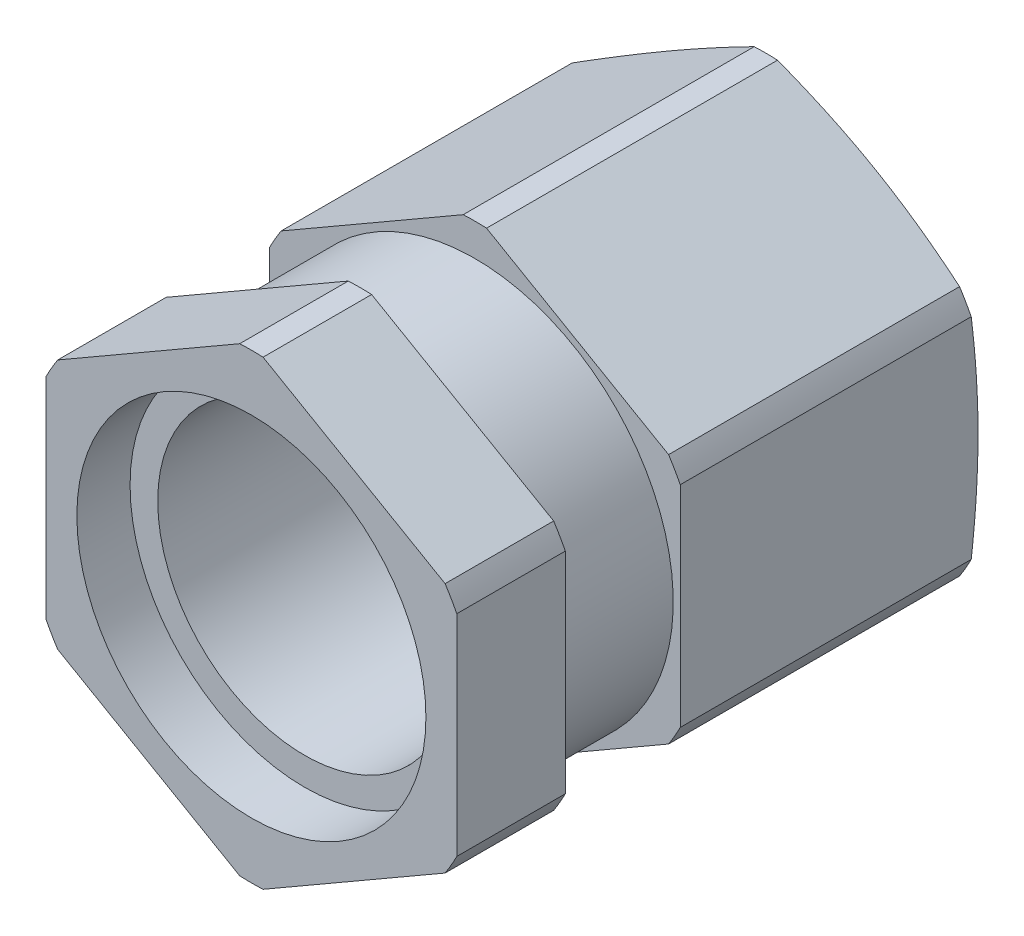
from build123d import *

# Parameters (mm, degrees)
SKETCH2_OUTSIDE_W = 16.808
SKETCH2_OUTSIDE_H = 16.808
EXTRUDE2_DEPTH    = 15.748315158


with BuildPart() as part:
    # Sketch1 → Revolve1 (revolve)
    with BuildSketch(Plane(origin=(0, 0, 0), x_dir=(0, 0, -1), z_dir=(1, 0, 0)), mode=Mode.PRIVATE) as revolve1_sk:
        Polygon((0, 0), (0, 3.5), (-0.514462449, 5.42), (-7.35, 5.42), (-7.35, 4.66), (-10.05, 4.66), (-10.05, 5.42), (-12.6, 5.42), (-12.6, 4.1), (-11.35, 4.1), (-11.35, 3.45), (-6.5, 3.45), (-6.5, 1.5), (-4.801290929, 1.5), (-3.9, 0), align=None)
    revolve(revolve1_sk.sketch.rotate(Axis((0, 0, 0), (0, 0, 1)), 90), axis=Axis((0, 0, 0), (0, 0, 1)))

    # Sketch2 outside → Extrude2 (cut, through all)
    with BuildSketch(Plane(origin=(0, 0, 0), x_dir=(-1, 0, 0), z_dir=(0, 0, -1))):
        Rectangle(SKETCH2_OUTSIDE_W, SKETCH2_OUTSIDE_H)
        Polygon((4.825, 2.785715049), (0, 5.571430098), (-4.825, 2.785715049), (-4.825, -2.785715049), (0, -5.571430098), (4.825, -2.785715049), align=None, mode=Mode.SUBTRACT)
    extrude(amount=-EXTRUDE2_DEPTH, mode=Mode.SUBTRACT)


solid = part.part
